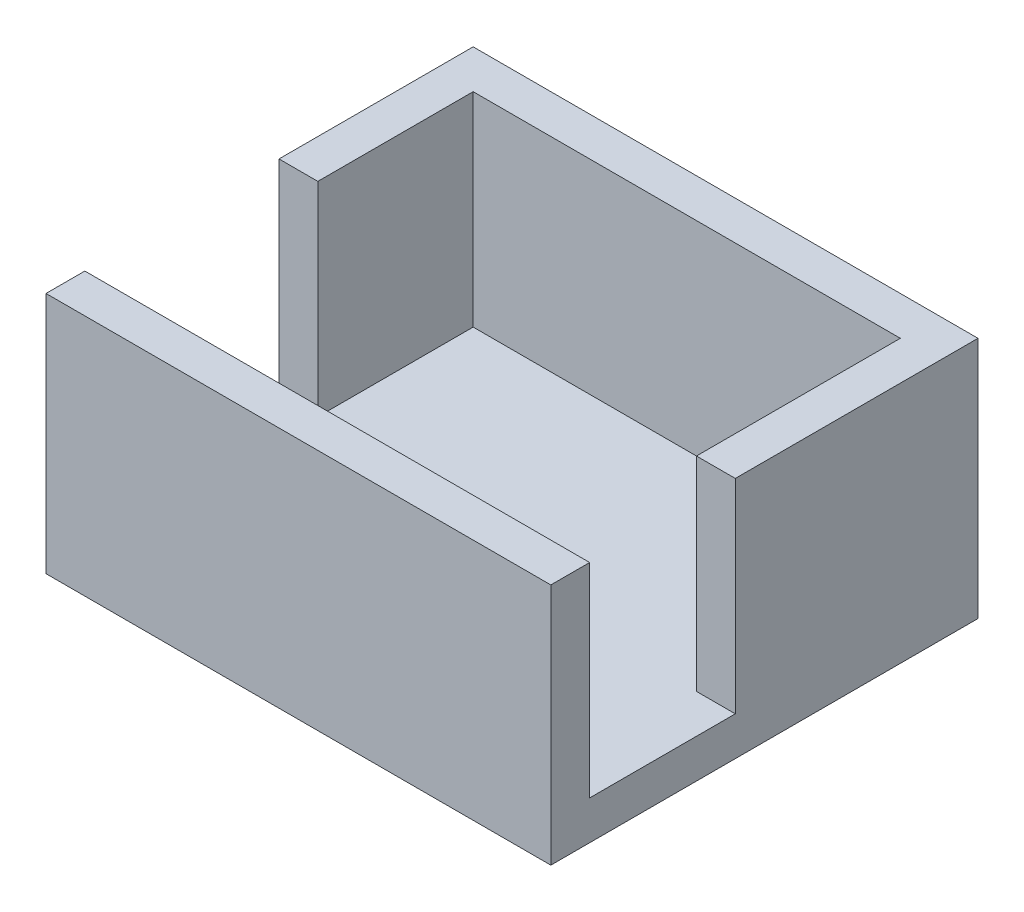
from build123d import *

# Parameters (mm, degrees)
SKETCH1_W           = 26
SKETCH1_H           = 22
SKETCH1_W_2         = 22
SKETCH1_H_2         = 18
BOSS_EXTRUDE1_DEPTH = 2
SKETCH1_3_W         = 26
SKETCH1_3_H         = 22
SKETCH1_3_W_2       = 22
SKETCH1_3_H_2       = 18
BOSS_EXTRUDE2_DEPTH = 12.5
SKETCH2_W           = 2
SKETCH2_H           = 10
SKETCH2_H_2         = 7.5
CUT_EXTRUDE1_DEPTH  = 10.5


with BuildPart() as part:
    # Sketch1 → Boss-Extrude1 (new body)
    # profile 1 of 2: a face of its own
    with BuildSketch(Plane(origin=(0, 0, 0), x_dir=(1, 0, 0), z_dir=(0, 1, 0))):
        with Locations((11, 9)):
            Rectangle(SKETCH1_W, SKETCH1_H)
        with Locations((11, 9)):
            Rectangle(SKETCH1_W_2, SKETCH1_H_2, mode=Mode.SUBTRACT)
    # profile 2 of 2: a face of its own
    with BuildSketch(Plane(origin=(0, 0, 0), x_dir=(1, 0, 0), z_dir=(0, 1, 0))):
        with Locations((11, 9)):
            Rectangle(SKETCH1_W_2, SKETCH1_H_2)
    extrude(amount=BOSS_EXTRUDE1_DEPTH)

    # Sketch1<3> → Boss-Extrude2 (add)
    with BuildSketch(Plane(origin=(0, 0, 0), x_dir=(1, 0, 0), z_dir=(0, 1, 0))):
        with Locations((11, 9)):
            Rectangle(SKETCH1_3_W, SKETCH1_3_H)
        with Locations((11, 9)):
            Rectangle(SKETCH1_3_W_2, SKETCH1_3_H_2, mode=Mode.SUBTRACT)
    extrude(amount=BOSS_EXTRUDE2_DEPTH)

    # Sketch2 → Cut-Extrude1 (cut)
    with BuildSketch(Plane(origin=(0, 12.5, 0), x_dir=(1, 0, 0), z_dir=(0, 1, 0))):
        with Locations((-1, 5)):
            Rectangle(SKETCH2_W, SKETCH2_H)
        with Locations((23, 3.75)):
            Rectangle(SKETCH2_W, SKETCH2_H_2)
    extrude(amount=-CUT_EXTRUDE1_DEPTH, mode=Mode.SUBTRACT)


solid = part.part
